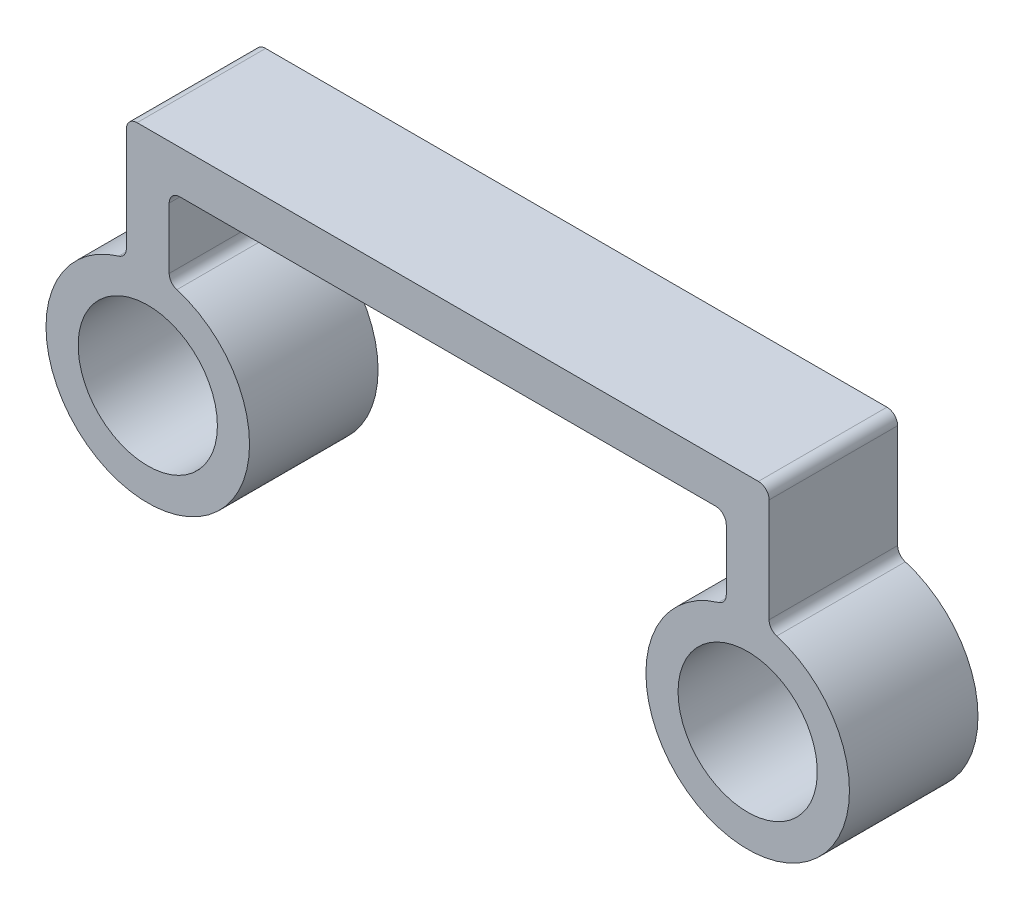
from build123d import *

# Parameters (mm, degrees)
SKETCH1_R           = 6.5
BOSS_EXTRUDE1_DEPTH = 12
FILLET1_R           = 1


with BuildPart() as part:
    # Sketch1 → Boss-Extrude1 (new body)
    with BuildSketch(Plane.XY):
        with BuildLine():
            Line((-26, 9.287087811), (-26, 16.75))
            Line((-26, 16.75), (0, 16.75))
            Line((0, 16.75), (0, 20.75))
            Line((0, 20.75), (-30, 20.75))
            Line((-30, 20.75), (-30, 9.287087811))
            ThreePointArc((-30, 9.287087811), (-28, -9.5), (-26, 9.287087811))
        make_face()
        with Locations((-28, 0)):
            Circle(SKETCH1_R, mode=Mode.SUBTRACT)
    boss_extrude1 = extrude(amount=BOSS_EXTRUDE1_DEPTH)

    # Mirror1: Boss-Extrude1 across plane
    add(boss_extrude1.mirror(Plane(origin=(0, 0, 0), x_dir=(0, 0, 1), z_dir=(1, 0, 0))))

    # Fillet1
    fillet1_edges = [part.edges().sort_by_distance(p)[0] for p in [
        (-30, 9.287087811, 6),
        (-30, 20.75, 6),
        (-26, 16.75, 6),
        (-26, 9.287087811, 6),
        (26, 9.287087811, 6),
        (30, 9.287087811, 6),
        (30, 20.75, 6),
        (26, 16.75, 6),
    ]]
    fillet(fillet1_edges, radius=FILLET1_R)


solid = part.part
